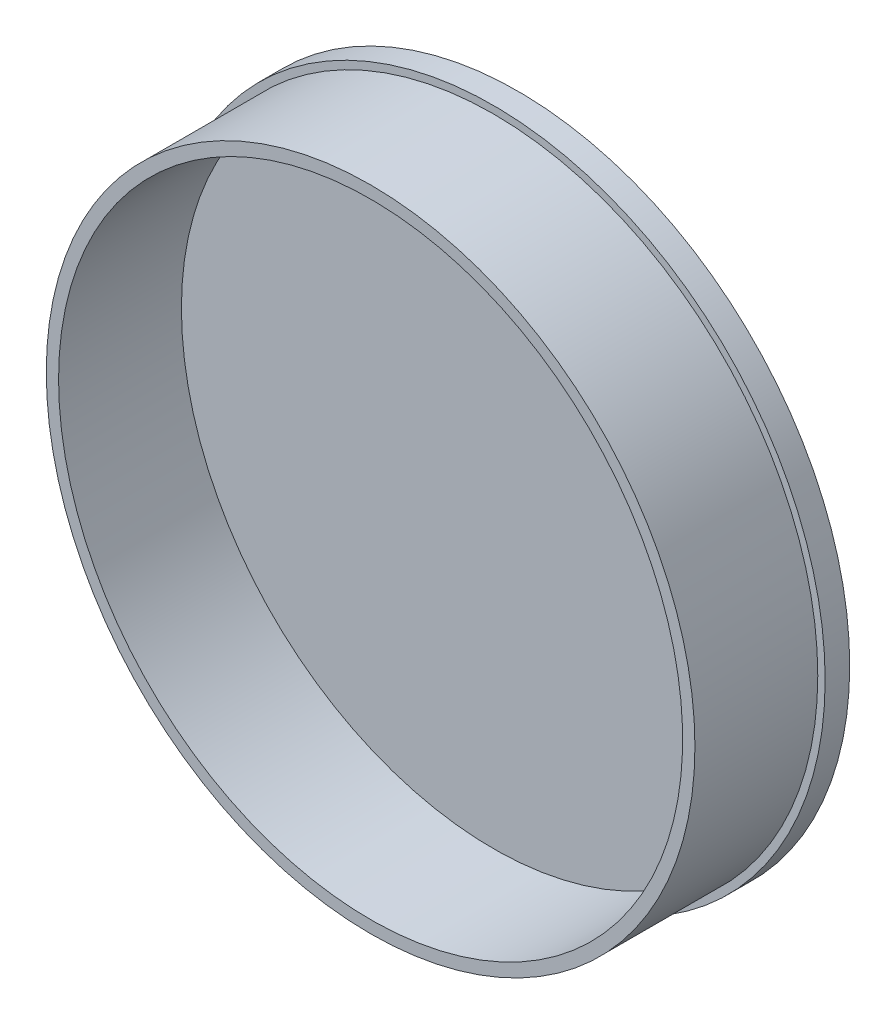
from build123d import *

# Parameters (mm, degrees)
SKETCH1_R           = 135
BOSS_EXTRUDE1_DEPTH = 5
SKETCH2_R           = 132
SKETCH2_R_2         = 127
BOSS_EXTRUDE2_DEPTH = 50


with BuildPart() as part:
    # Sketch1 → Boss-Extrude1 (new, symmetric)
    with BuildSketch(Plane.XY):
        Circle(SKETCH1_R)
    extrude(amount=BOSS_EXTRUDE1_DEPTH, both=True)

    # Sketch2 → Boss-Extrude2 (add)
    with BuildSketch(Plane.XY.offset(5)):
        with Locations(Location((0, 0, 0), (0, 0, 180))):
            Circle(SKETCH2_R)
        with Locations(Location((0, 0, 0), (0, 0, 180))):
            Circle(SKETCH2_R_2, mode=Mode.SUBTRACT)
    extrude(amount=BOSS_EXTRUDE2_DEPTH)


solid = part.part
